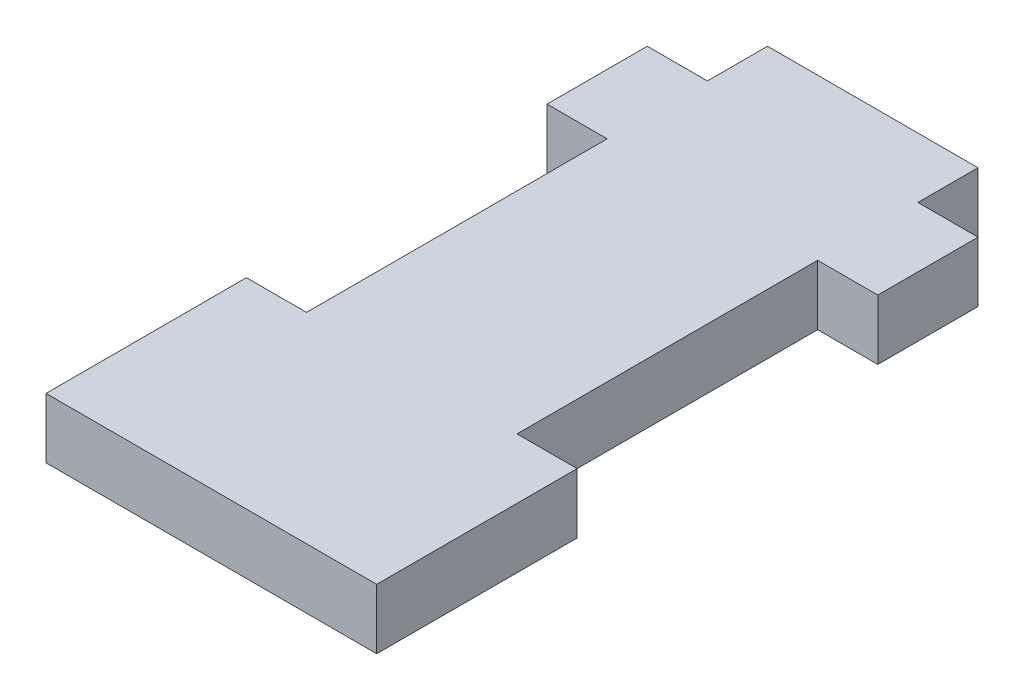
from build123d import *

# Parameters (mm, degrees)
SKETCH_1_W      = 3
SKETCH_1_H      = 10
SKETCH_1_H_2    = 5
EXTRUDE_1_DEPTH = 3


with BuildPart() as part:
    # 草图1 → 凸台-拉伸1 (new body)
    with BuildSketch(Plane(origin=(0, 0, 0), x_dir=(1, 0, 0), z_dir=(0, 1, 0))):
        Polygon((0, -45), (0, -55), (10.5, -55), (10.5, -45), (10.5, -30), (10.5, -25), (10.5, -22), (0, -22), (0, -25), (0, -30), align=None)
        with Locations((12, -50)):
            Rectangle(SKETCH_1_W, SKETCH_1_H)
        with Locations((-1.5, -50)):
            Rectangle(SKETCH_1_W, SKETCH_1_H)
        with Locations((-1.5, -27.5)):
            Rectangle(SKETCH_1_W, SKETCH_1_H_2)
        with Locations((12, -27.5)):
            Rectangle(SKETCH_1_W, SKETCH_1_H_2)
    extrude(amount=EXTRUDE_1_DEPTH)


solid = part.part
